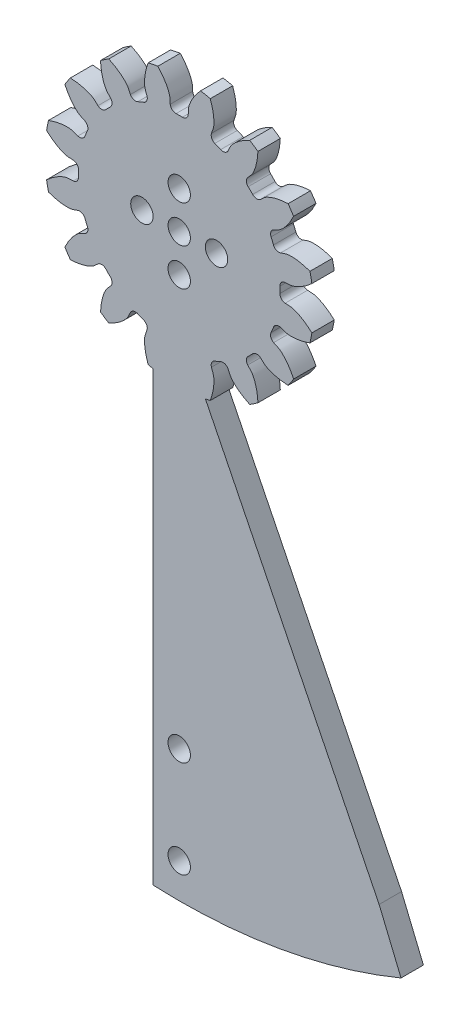
from build123d import *

# Parameters (mm, degrees)
SKETCH_1_R          = 18
LASHENA_DEPTH       = 3
CUT_EXTRUDEA_DEPTH  = 3
WWW_KYTOOL_CN_COUNT = 16
SKETCH_3_R          = 1.5
CUT_EXTRUDE_2_DEPTH = 10
SKETCH_4_R          = 1.5
CUT_EXTRUDE_3_DEPTH = 10
SKETCH_5_W          = 7.023251592
SKETCH_5_H          = 5.670576874
EXTRUDE_3_DEPTH     = 3
SKETCH_6_R          = 1.5
CUT_EXTRUDE_4_DEPTH = 3
EXTRUDE_4_DEPTH     = 3


with BuildPart() as part:
    # 草图1 → LaShenA (new body)
    with BuildSketch(Plane.XY):
        Circle(SKETCH_1_R)
    extrude(amount=LASHENA_DEPTH)

    # SketchA → Cut-ExtrudeA (cut)
    with BuildSketch(Plane.XY.offset(3)):
        with BuildLine():
            ThreePointArc((0.423212707, 13.493364703), (0, 13.5), (-0.423212707, 13.493364703))
            ThreePointArc((-0.423212707, 13.493364703), (-0.952770902, 13.685686791), (-1.20440395, 14.18977059))
            add(Edge.make_bspline(
                [(-1.20440395, 14.18977059), (-1.226562505, 14.455224305), (-1.213843633, 14.773889884), (-1.273675597, 15.110607864), (-1.299119688, 15.21139578), (-1.321432077, 15.29109757), (-1.349914152, 15.382250837), (-1.385146673, 15.484587535), (-1.427834192, 15.597770763), (-1.478623281, 15.721446817), (-1.538159915, 15.855229004), (-1.607069773, 15.998703507), (-1.685962928, 16.151428337), (-1.775430978, 16.312934487), (-1.876046532, 16.482726463), (-1.98836201, 16.660283053), (-2.112908684, 16.845058076), (-2.250195688, 17.036481179), (-2.400709063, 17.233958676), (-2.56491084, 17.43687441), (-2.743238138, 17.644590662), (-2.936102365, 17.856449073), (-3.14388814, 18.07177164), (-3.447378451, 18.368492697), (-3.689495989, 18.585006365), (-3.858042439, 18.727457792)],
                knots=[0.122308221, 0.122308221, 0.122308221, 0.122308221, 0.250610689, 0.276296194, 0.287604067, 0.300967916, 0.316387742, 0.333863545, 0.353395324, 0.37498308, 0.398626813, 0.424326522, 0.452082207, 0.48189387, 0.513761509, 0.547685125, 0.583664717, 0.621700286, 0.661791832, 0.703939355, 0.748142854, 0.79440233, 0.842717782, 0.893089212, 1, 1, 1, 1], degree=3))
            ThreePointArc((-3.858042439, 18.727457792), (0, 19.120726106), (3.858042439, 18.727457792))
            add(Edge.make_bspline(
                [(1.20440395, 14.18977059), (1.226562505, 14.455224305), (1.213843633, 14.773889884), (1.273675597, 15.110607864), (1.299119688, 15.21139578), (1.321432077, 15.29109757), (1.349914152, 15.382250837), (1.385146673, 15.484587535), (1.427834192, 15.597770763), (1.478623281, 15.721446817), (1.538159915, 15.855229004), (1.607069773, 15.998703507), (1.685962928, 16.151428337), (1.775430978, 16.312934487), (1.876046532, 16.482726463), (1.98836201, 16.660283053), (2.112908684, 16.845058076), (2.250195688, 17.036481179), (2.400709063, 17.233958676), (2.56491084, 17.43687441), (2.743238138, 17.644590662), (2.936102365, 17.856449073), (3.14388814, 18.07177164), (3.447378451, 18.368492697), (3.689495989, 18.585006365), (3.858042439, 18.727457792)],
                knots=[0.122308221, 0.122308221, 0.122308221, 0.122308221, 0.250610689, 0.276296194, 0.287604067, 0.300967916, 0.316387742, 0.333863545, 0.353395324, 0.37498308, 0.398626813, 0.424326522, 0.452082207, 0.48189387, 0.513761509, 0.547685125, 0.583664717, 0.621700286, 0.661791832, 0.703939355, 0.748142854, 0.79440233, 0.842717782, 0.893089212, 1, 1, 1, 1], degree=3))
            ThreePointArc((1.20440395, 14.18977059), (0.952770902, 13.685686791), (0.423212707, 13.493364703))
        make_face()
    cut_extrudea = extrude(amount=-CUT_EXTRUDEA_DEPTH, mode=Mode.SUBTRACT)

    # www.KYTool.cn: Cut-ExtrudeA ×16 about axis
    www_kytool_cn_axis = Axis((0, 0, -80.9), (0, 0, 1))
    for i in range(1, WWW_KYTOOL_CN_COUNT):
        add(cut_extrudea.rotate(www_kytool_cn_axis, i * 360 / WWW_KYTOOL_CN_COUNT), mode=Mode.SUBTRACT)

    # 草图3 → 切除-拉伸2 (cut)
    with BuildSketch(Plane(origin=(0, 0, 0), x_dir=(-1, 0, 0), z_dir=(0, 0, -1))):
        Circle(SKETCH_3_R)
    extrude(amount=-CUT_EXTRUDE_2_DEPTH, mode=Mode.SUBTRACT)

    # 草图4 → 切除-拉伸3 (cut)
    with BuildSketch(Plane(origin=(0, 0, 0), x_dir=(-1, 0, 0), z_dir=(0, 0, -1))):
        with Locations((5, 0)):
            Circle(SKETCH_4_R)
        with Locations((0, -5)):
            Circle(SKETCH_4_R)
        with Locations((-5, 0)):
            Circle(SKETCH_4_R)
        with Locations((0, 5)):
            Circle(SKETCH_4_R)
    extrude(amount=-CUT_EXTRUDE_3_DEPTH, mode=Mode.SUBTRACT)

    # 草图5 → 凸台-拉伸3 (add)
    with BuildSketch(Plane(origin=(0, 0, 0), x_dir=(-1, 0, 0), z_dir=(0, 0, -1))):
        with Locations((0, -14.81884661)):
            Rectangle(SKETCH_5_W, SKETCH_5_H)
        with BuildLine():
            ThreePointArc((3.511625796, -17.654135047), (0, -18), (-3.511625796, -17.654135047))
            Line((-3.511625796, -17.654135047), (-3.511625796, -69.911862257))
            ThreePointArc((-3.511625796, -69.911862257), (0, -70), (3.511625796, -69.911862257))
            Line((3.511625796, -69.911862257), (3.511625796, -17.654135047))
        make_face()
        with BuildLine():
            ThreePointArc((3.511625796, -69.911862257), (0, -70), (-3.511625796, -69.911862257))
            Line((-3.511625796, -69.911862257), (-3.511625796, -77.574694161))
            ThreePointArc((-3.511625796, -77.574694161), (0, -77.654135047), (3.511625796, -77.574694161))
            Line((3.511625796, -77.574694161), (3.511625796, -69.911862257))
        make_face()
        with BuildLine():
            Line((-3.511625796, -77.574694161), (-3.511625796, -69.911862257))
            ThreePointArc((-3.511625796, -69.911862257), (-15.374640932, -68.290705196), (-26.787840266, -64.671567276))
            Line((-26.787840266, -64.671567276), (-29.716950937, -71.743065985))
            ThreePointArc((-29.716950937, -71.743065985), (-16.868211219, -75.799921769), (-3.511625796, -77.574694161))
        make_face()
        with BuildLine():
            Line((3.511625796, -17.654135047), (-3.511625796, -17.654135047))
            ThreePointArc((-3.511625796, -17.654135047), (0, -18), (3.511625796, -17.654135047))
        make_face()
    extrude(amount=-EXTRUDE_3_DEPTH)

    # 草图6 → 切除-拉伸4 (cut)
    with BuildSketch(Plane.XY.offset(3)):
        with Locations((0, -60)):
            Circle(SKETCH_6_R)
        with Locations((0, -73)):
            Circle(SKETCH_6_R)
    extrude(amount=-CUT_EXTRUDE_4_DEPTH, mode=Mode.SUBTRACT)

    # 草图7 → 凸台-拉伸4 (add)
    with BuildSketch(Plane.XY.offset(3)):
        Polygon((26.787840266, -64.671567276), (3.511625796, -17.654135047), (3.511625796, -69.911862257), (15.374640932, -76.116917345), align=None)
    extrude(amount=-EXTRUDE_4_DEPTH)


solid = part.part
